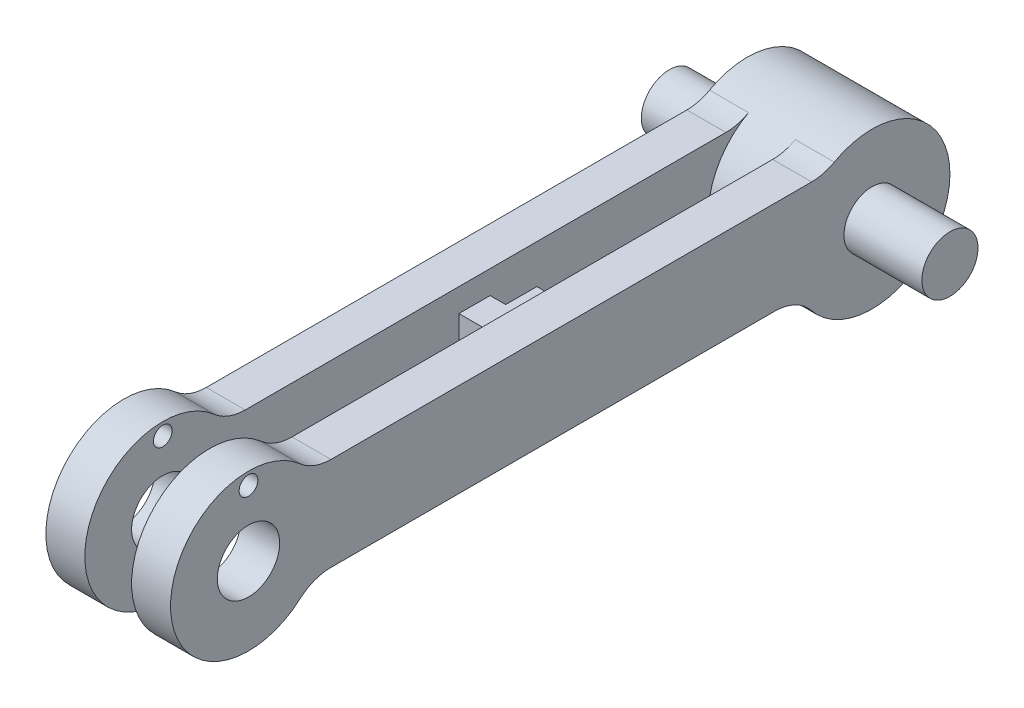
from build123d import *

# Parameters (mm, degrees)
SKETCH_1_R                  = 5
SKETCH_1_R_2                = 0.6
SKETCH_1_W                  = 40
SKETCH_1_H                  = 6
EXTRUDE_1_DEPTH             = 2.5
CUT_EXTRUDE_2_DEPTH         = 46.467021015
CUT_EXTRUDE_2_DEPTH_BACK    = 46.467021015
SKETCH_1_3_R                = 2
FILLET_1_R                  = 3
EXTRUDE_START               = -1.5
SKETCH_1_4_R                = 5
SKETCH_1_4_R_2              = 2
EXTRUDE_2_DEPTH             = 1.5
SKETCH_2_R                  = 1.8
EXTRUDE_4_DEPTH             = 5
EXTRUDE_5_REACH             = 48.014
SKETCH_1_5_R                = 2
EXTRUDE_5_DIRECTION_2_REACH = 48.014
SKETCH_3_W                  = 2
SKETCH_3_H                  = 3
EXTRUDE_8_DEPTH             = 1.5
SKETCH_4_W                  = 0.5
SKETCH_4_H                  = 1.5
EXTRUDE_9_DEPTH             = 2


with BuildPart() as part:
    # 草图1 → 凸台-拉伸1 (new body)
    # profile 1 of 3: a face of its own
    with BuildSketch(Plane(origin=(0, 0, 0), x_dir=(0, 0, -1), z_dir=(1, 0, 0))):
        Circle(SKETCH_1_R)
        with Locations((0, 4.2)):
            Circle(SKETCH_1_R_2, mode=Mode.SUBTRACT)
    # profile 2 of 3: a face of its own
    with BuildSketch(Plane(origin=(0, 0, 0), x_dir=(0, 0, -1), z_dir=(1, 0, 0))):
        with Locations((40, -1)):
            Circle(SKETCH_1_R)
    # profile 3 of 3: a face of its own
    with BuildSketch(Plane(origin=(0, 0, 0), x_dir=(0, 0, -1), z_dir=(1, 0, 0))):
        with Locations((20, 0)):
            Rectangle(SKETCH_1_W, SKETCH_1_H)
    extrude(amount=EXTRUDE_1_DEPTH)

    # 草图1<3> → 切除-拉伸2 (cut, two sides: drawn at the far end of the back side and taken through both)
    with BuildSketch(Plane(origin=(0, 0, 0), x_dir=(0, 0, -1), z_dir=(1, 0, 0)).offset(-CUT_EXTRUDE_2_DEPTH_BACK)):
        Circle(SKETCH_1_3_R)
        with Locations((40, -1)):
            Circle(SKETCH_1_3_R)
    extrude(amount=CUT_EXTRUDE_2_DEPTH + CUT_EXTRUDE_2_DEPTH_BACK, mode=Mode.SUBTRACT)

    # 圆角1
    fillet_1_edges = [part.edges().sort_by_distance(p)[0] for p in [
        (1.25, -3, -4),
        (1.25, -3, -35.417424305),
        (1.25, 3, -37),
        (1.25, 3, -4),
    ]]
    fillet(fillet_1_edges, radius=FILLET_1_R)

    # 草图1<4> → 凸台-拉伸2 (add)
    with BuildSketch(Plane(origin=(0, 0, 0), x_dir=(0, 0, -1), z_dir=(1, 0, 0)).offset(EXTRUDE_START)):
        with Locations((40, -1)):
            Circle(SKETCH_1_4_R)
        with Locations((40, -1)):
            Circle(SKETCH_1_4_R_2, mode=Mode.SUBTRACT)
    extrude(amount=EXTRUDE_2_DEPTH)

    # 凸台-拉伸5: up to this face of the body (flat: up to its plane)
    extrude_5_end = Plane(part.part.faces().sort_by_distance((2.5, -0.21352009, -20.113168079))[0])
    # 草图1<5> → 凸台-拉伸5 (add, up to the picked face)
    with BuildSketch(Plane(origin=(0, 0, 0), x_dir=(0, 0, -1), z_dir=(1, 0, 0)), mode=Mode.PRIVATE) as extrude_5_sk1:
        with Locations((40, -1)):
            Circle(SKETCH_1_5_R)
    extrude_5_tool1 = split(extrude(extrude_5_sk1.sketch, amount=EXTRUDE_5_REACH, mode=Mode.PRIVATE), bisect_by=extrude_5_end, keep=Keep.BOTH, mode=Mode.PRIVATE)


with BuildPart() as body_2:
    # 草图2 → 凸台-拉伸4 (new body)
    with BuildSketch(Plane(origin=(2.5, 0, 0), x_dir=(0, 0, -1), z_dir=(1, 0, 0))):
        with Locations((40, -1)):
            Circle(SKETCH_2_R)
    extrude(amount=EXTRUDE_4_DEPTH)


with BuildPart() as part_1:
    add(part.part)

    add(body_2.part)  # 凸台-拉伸5 merges body 2
    add(extrude_5_tool1.solids().sort_by(Axis((0, -1, -40), (1, 0, 0)))[0])

    # 凸台-拉伸5 direction 2: up to this face of the body (flat: up to its plane)
    extrude_5_direction_2_end = Plane(part_1.part.faces().sort_by_distance((-1.5, -1, -35.141421356))[0])
    # 草图1<5> → 凸台-拉伸5 direction 2 (add, up to the picked face)
    with BuildSketch(Plane(origin=(0, 0, 0), x_dir=(0, 0, -1), z_dir=(1, 0, 0)), mode=Mode.PRIVATE) as extrude_5_direction_2_sk1:
        with Locations((40, -1)):
            Circle(SKETCH_1_5_R)
    extrude_5_direction_2_tool1 = split(extrude(extrude_5_direction_2_sk1.sketch, amount=-EXTRUDE_5_DIRECTION_2_REACH, mode=Mode.PRIVATE), bisect_by=extrude_5_direction_2_end, keep=Keep.BOTH, mode=Mode.PRIVATE)
    add(extrude_5_direction_2_tool1.solids().sort_by(Axis((0, -1, -40), (-1, 0, 0)))[0])

    # 草图3 → 凸台-拉伸8 (add)
    with BuildSketch(Plane.ZY):
        with Locations((-20, 0)):
            Rectangle(SKETCH_3_W, SKETCH_3_H)
    extrude(amount=EXTRUDE_8_DEPTH)

    # 草图4 → 凸台-拉伸9 (add)
    with BuildSketch(Plane(origin=(0, 0, -21), x_dir=(-1, 0, 0), z_dir=(0, 0, -1))):
        with Locations((1.25, 0.75)):
            Rectangle(SKETCH_4_W, SKETCH_4_H)
    extrude(amount=EXTRUDE_9_DEPTH)

    # 镜向3: part across plane


with BuildPart() as part_2:
    add(part_1.part)
    add(part_1.part.mirror(Plane.ZY.offset(1.5)))


solid = part_2.part
